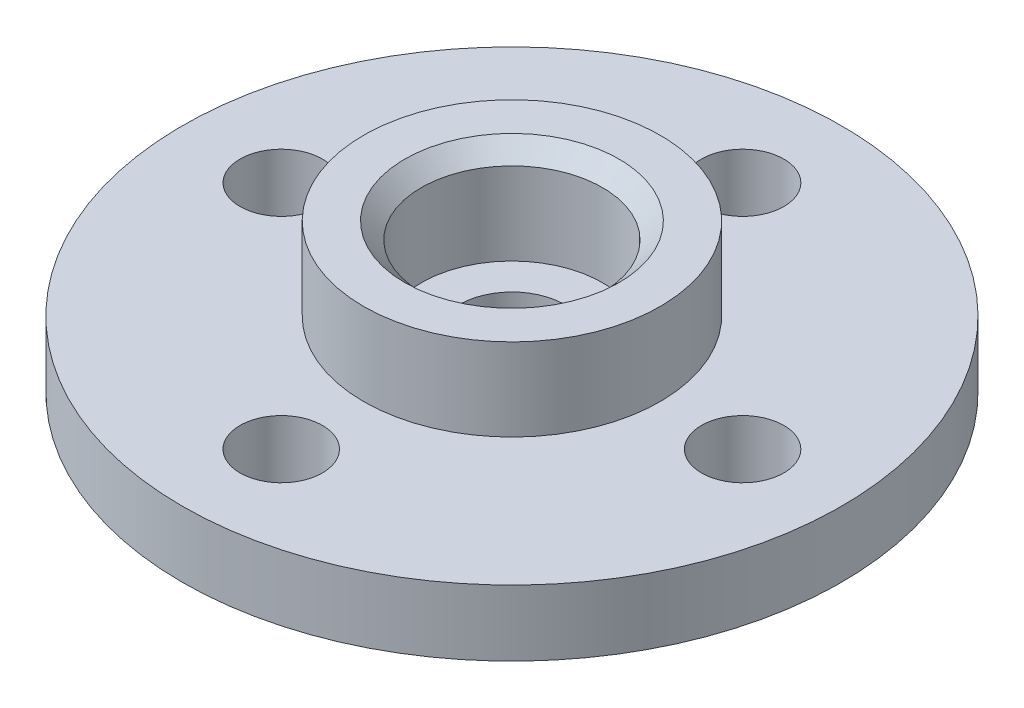
from build123d import *

# Parameters (mm, degrees)
SKETCH_1_R          = 10
EXTRUDE_1_DEPTH     = 2
SKETCH_2_R          = 4.5
EXTRUDE_2_DEPTH     = 2.5
SKETCH_4_R          = 1.25
CUT_EXTRUDE_1_DEPTH = 2.5
SKETCH_5_R          = 2.75
CUT_EXTRUDE_2_DEPTH = 3
SKETCH_6_R          = 1.6
CUT_EXTRUDE_3_DEPTH = 3
CHAMFER_1_SIZE      = 0.5


with BuildPart() as part:
    # 草图1 → 凸台-拉伸1 (new body)
    with BuildSketch(Plane(origin=(0, 0, 0), x_dir=(1, 0, 0), z_dir=(0, 1, 0))):
        with Locations(Location((0, 0, 0), (0, 0, 270))):
            Circle(SKETCH_1_R)
    extrude(amount=EXTRUDE_1_DEPTH)

    # 草图2 → 凸台-拉伸2 (add)
    with BuildSketch(Plane(origin=(0, 2, 0), x_dir=(1, 0, 0), z_dir=(0, 1, 0))):
        with Locations(Location((0, 0, 0), (0, 0, 270))):
            Circle(SKETCH_2_R)
    extrude(amount=EXTRUDE_2_DEPTH)

    # 草图4 → 切除-拉伸1 (cut)
    with BuildSketch(Plane(origin=(0, 2, 0), x_dir=(1, 0, 0), z_dir=(0, 1, 0))):
        with Locations(Location((0, 7, 0), (0, 0, 270))):
            Circle(SKETCH_4_R)
        with Locations(Location((7, 0, 0), (0, 0, 270))):
            Circle(SKETCH_4_R)
        with Locations(Location((0, -7, 0), (0, 0, 270))):
            Circle(SKETCH_4_R)
        with Locations(Location((-7, 0, 0), (0, 0, 270))):
            Circle(SKETCH_4_R)
    extrude(amount=-CUT_EXTRUDE_1_DEPTH, mode=Mode.SUBTRACT)

    # 草图5 → 切除-拉伸2 (cut)
    with BuildSketch(Plane(origin=(0, 4.5, 0), x_dir=(1, 0, 0), z_dir=(0, 1, 0))):
        with Locations(Location((0, 0, 0), (0, 0, 270))):
            Circle(SKETCH_5_R)
    extrude(amount=-CUT_EXTRUDE_2_DEPTH, mode=Mode.SUBTRACT)

    # 草图6 → 切除-拉伸3 (cut)
    with BuildSketch(Plane(origin=(0, 1.5, 0), x_dir=(1, 0, 0), z_dir=(0, 1, 0))):
        with Locations(Location((0, 0, 0), (0, 0, 270))):
            Circle(SKETCH_6_R)
    extrude(amount=-CUT_EXTRUDE_3_DEPTH, mode=Mode.SUBTRACT)

    # 倒角1
    chamfer_1_edges = [part.edges().sort_by_distance(p)[0] for p in [
        (0, 4.5, -2.75),
    ]]
    chamfer(chamfer_1_edges, length=CHAMFER_1_SIZE)


solid = part.part
